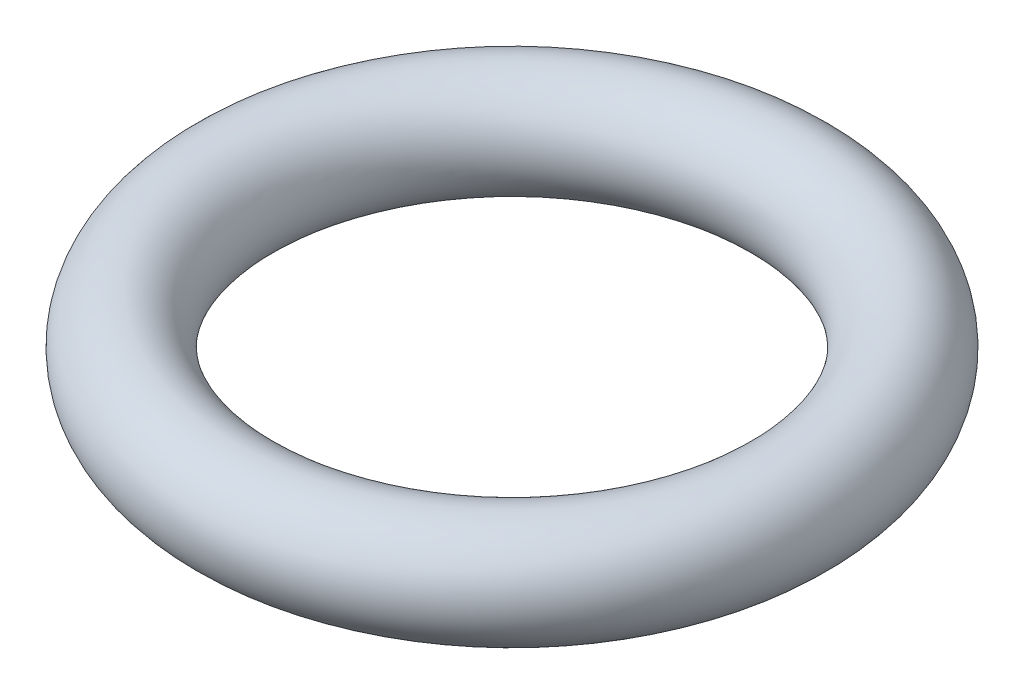
from build123d import *

# Parameters (mm, degrees)
SKETCH2_R = 2.24


with BuildPart() as part:
    # Sweep1: sweep along a path in Sketch1
    with BuildLine(Plane(origin=(0, 0, 0), x_dir=(1, 0, 0), z_dir=(0, 1, 0))) as sweep1_path:
        CenterArc((0, 0), 11.645, 0, 360)
    # Sketch2 → Sweep1 (sweep)
    with BuildSketch(Plane(origin=(0, 0, 0), x_dir=(0, 0, -1), z_dir=(1, 0, 0))):
        with Locations((-11.645, 0)):
            Circle(SKETCH2_R)
    sweep(path=sweep1_path.line)


solid = part.part
